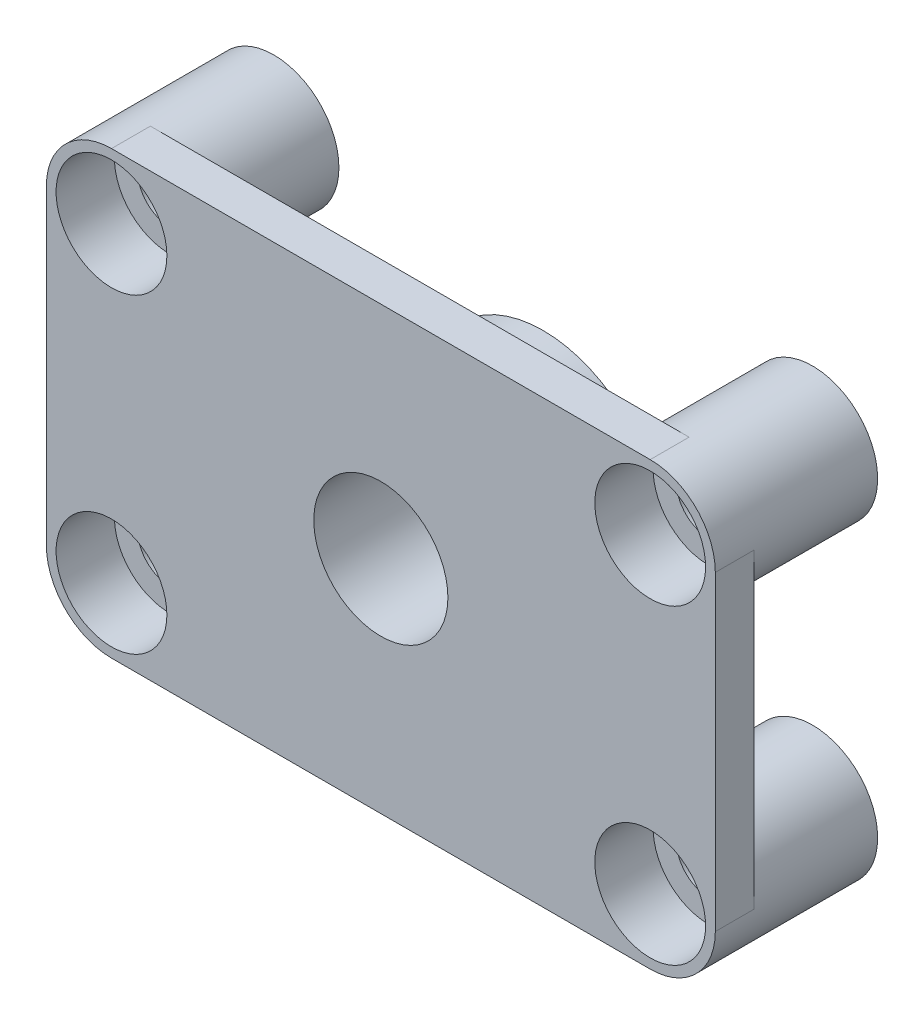
from build123d import *
from build123d.topology import SkipClean

# Parameters (mm, degrees)
SKETCH1_R             = 3.35
SKETCH1_R_2           = 1.65
BOSS_EXTRUDE1_DEPTH   = 6.35
BOSS_EXTRUDE1_2_DEPTH = 6.35
BOSS_EXTRUDE1_3_DEPTH = 6.35
BOSS_EXTRUDE1_4_DEPTH = 6.35
SKETCH1_R_3           = 6
SKETCH1_R_4           = 3.45
BOSS_EXTRUDE1_5_DEPTH = 6.35
SKETCH2_R             = 1.65
SKETCH2_R_2           = 6
SKETCH2_R_3           = 3.45
BOSS_EXTRUDE2_DEPTH   = 2
SKETCH3_R             = 2.85
CUT_EXTRUDE1_DEPTH    = 3


with BuildPart() as part:
    # Sketch1 → Boss-Extrude1 (new body)
    with BuildSketch(Plane.XY):
        with Locations((-13.856406461, 8)):
            Circle(SKETCH1_R)
        with Locations((-13.856406461, 8)):
            Circle(SKETCH1_R_2, mode=Mode.SUBTRACT)
    extrude(amount=BOSS_EXTRUDE1_DEPTH)



with BuildPart() as body_2:
    # Sketch1 → Boss-Extrude1 2 (new body)
    with BuildSketch(Plane.XY):
        with Locations(Location((-13.856406461, -8, 0), (0, 0, 180))):
            Circle(SKETCH1_R)
        with Locations(Location((-13.856406461, -8, 0), (0, 0, 180))):
            Circle(SKETCH1_R_2, mode=Mode.SUBTRACT)
    extrude(amount=BOSS_EXTRUDE1_2_DEPTH)


with BuildPart() as body_3:
    # Sketch1 → Boss-Extrude1 3 (new body)
    with BuildSketch(Plane.XY):
        with Locations((13.856406461, -8)):
            Circle(SKETCH1_R)
        with Locations((13.856406461, -8)):
            Circle(SKETCH1_R_2, mode=Mode.SUBTRACT)
    extrude(amount=BOSS_EXTRUDE1_3_DEPTH)


with BuildPart() as body_4:
    # Sketch1 → Boss-Extrude1 4 (new body)
    with BuildSketch(Plane.XY):
        with Locations(Location((13.856406461, 8, 0), (0, 0, 180))):
            Circle(SKETCH1_R)
        with Locations(Location((13.856406461, 8, 0), (0, 0, 180))):
            Circle(SKETCH1_R_2, mode=Mode.SUBTRACT)
    extrude(amount=BOSS_EXTRUDE1_4_DEPTH)


with BuildPart() as body_5:
    # Sketch1 → Boss-Extrude1 5 (new body)
    with BuildSketch(Plane.XY):
        Circle(SKETCH1_R_3)
        Circle(SKETCH1_R_4, mode=Mode.SUBTRACT)
    extrude(amount=BOSS_EXTRUDE1_5_DEPTH)


with BuildPart() as part_1:
    with SkipClean():  # the faces are left unmerged after this step: merging them gives an invalid solid
        add(part.part)

        add(body_2.part)  # Boss-Extrude2 merges body 2

        add(body_3.part)  # Boss-Extrude2 merges body 3

        add(body_4.part)  # Boss-Extrude2 merges body 4

        add(body_5.part)  # Boss-Extrude2 merges body 5
        # Sketch2 → Boss-Extrude2 (add)
        # profile 1 of 2: a face of its own
        with BuildSketch(Plane.XY.offset(6.35)):
            with BuildLine():
                Line((-13.856406461, 11.35), (13.856406461, 11.35))
                ThreePointArc((13.856406461, 11.35), (16.225214178, 10.368807717), (17.206406461, 8))
                Line((17.206406461, 8), (17.206406461, -8))
                ThreePointArc((17.206406461, -8), (16.225214178, -10.368807717), (13.856406461, -11.35))
                Line((13.856406461, -11.35), (-13.856406461, -11.35))
                ThreePointArc((-13.856406461, -11.35), (-16.225214178, -10.368807717), (-17.206406461, -8))
                Line((-17.206406461, -8), (-17.206406461, 8))
                ThreePointArc((-17.206406461, 8), (-16.225214178, 10.368807717), (-13.856406461, 11.35))
            make_face()
            with Locations((-13.856406461, 8)):
                Circle(SKETCH2_R, mode=Mode.SUBTRACT)
            with Locations(Location((-13.856406461, -8, 0), (0, 0, 180))):
                Circle(SKETCH2_R, mode=Mode.SUBTRACT)
            with Locations(Location((13.856406461, 8, 0), (0, 0, 180))):
                Circle(SKETCH2_R, mode=Mode.SUBTRACT)
            with Locations((13.856406461, -8)):
                Circle(SKETCH2_R, mode=Mode.SUBTRACT)
            Circle(SKETCH2_R_2, mode=Mode.SUBTRACT)
        # profile 2 of 2: a face of its own
        with BuildSketch(Plane.XY.offset(6.35)):
            Circle(SKETCH2_R_2)
            Circle(SKETCH2_R_3, mode=Mode.SUBTRACT)
        extrude(amount=BOSS_EXTRUDE2_DEPTH)

    # Sketch3 → Cut-Extrude1 (cut)
    with SkipClean():  # the faces are left unmerged after this step: merging them gives an invalid solid
        with BuildSketch(Plane.XY.offset(8.35)):
            with Locations((-13.856406461, 8)):
                Circle(SKETCH3_R)
            with Locations((-13.856406461, -8)):
                Circle(SKETCH3_R)
            with Locations((13.856406461, -8)):
                Circle(SKETCH3_R)
            with Locations((13.856406461, 8)):
                Circle(SKETCH3_R)
        extrude(amount=-CUT_EXTRUDE1_DEPTH, mode=Mode.SUBTRACT)


solid = part_1.part
